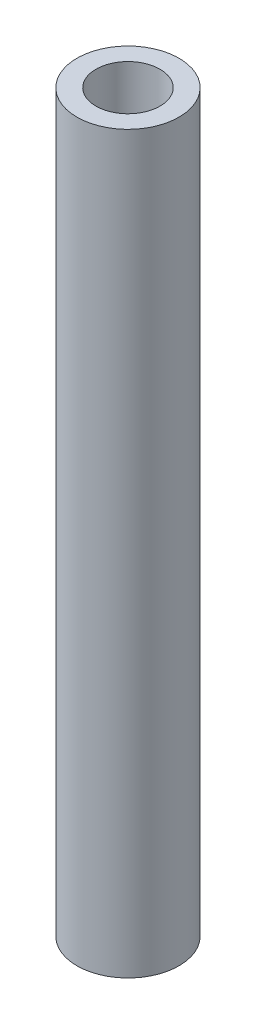
from build123d import *

# Parameters (mm, degrees)
SKETCH1_R           = 3.96875
SKETCH1_R_2         = 2.4892
BOSS_EXTRUDE2_DEPTH = 28.575


with BuildPart() as part:
    # Sketch1 → Boss-Extrude2 (new, symmetric)
    with BuildSketch(Plane(origin=(0, 0, 0), x_dir=(1, 0, 0), z_dir=(0, 1, 0))):
        with Locations(Location((0, 0, 0), (0, 0, 270))):
            Circle(SKETCH1_R)
        with Locations(Location((0, 0, 0), (0, 0, 270))):
            Circle(SKETCH1_R_2, mode=Mode.SUBTRACT)
    extrude(amount=BOSS_EXTRUDE2_DEPTH, both=True)


solid = part.part
